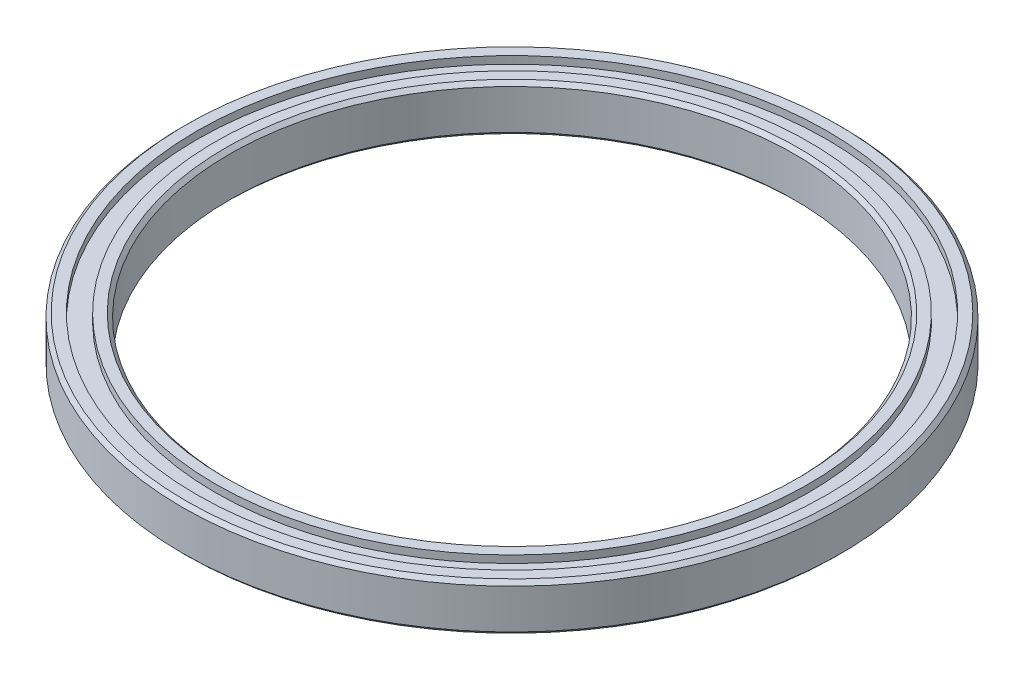
from build123d import *

# Parameters (mm, degrees)
SKETCH_1_R          = 44.45
SKETCH_1_R_2        = 38.1
EXTRUDE_1_DEPTH     = 6.35
SKETCH_2_R          = 42.5
SKETCH_2_R_2        = 40
CUT_EXTRUDE_1_DEPTH = 1
CUT_EXTRUDE_START   = -1
SKETCH_3_R          = 42.5
SKETCH_3_R_2        = 40
CUT_EXTRUDE_2_DEPTH = 1
CHAMFER_1_SIZE      = 0.5


with BuildPart() as part:
    # 草图1 → 凸台-拉伸1 (new body)
    with BuildSketch(Plane(origin=(0, 0, 0), x_dir=(1, 0, 0), z_dir=(0, 1, 0))):
        with Locations(Location((0, 0, 0), (0, 0, 270))):
            Circle(SKETCH_1_R)
        with Locations(Location((0, 0, 0), (0, 0, 270))):
            Circle(SKETCH_1_R_2, mode=Mode.SUBTRACT)
    extrude(amount=EXTRUDE_1_DEPTH)

    # 草图2 → 切除-拉伸1 (cut)
    with BuildSketch(Plane(origin=(0, 6.35, 0), x_dir=(1, 0, 0), z_dir=(0, 1, 0))):
        with Locations(Location((0, 0, 0), (0, 0, 270))):
            Circle(SKETCH_2_R)
        with Locations(Location((0, 0, 0), (0, 0, 270))):
            Circle(SKETCH_2_R_2, mode=Mode.SUBTRACT)
    extrude(amount=-CUT_EXTRUDE_1_DEPTH, mode=Mode.SUBTRACT)

    # 草图3 → 切除-拉伸2 (cut)
    with BuildSketch(Plane.XZ.offset(CUT_EXTRUDE_START)):
        with Locations(Location((0, 0, 0), (0, 0, 90))):
            Circle(SKETCH_3_R)
        with Locations(Location((0, 0, 0), (0, 0, 90))):
            Circle(SKETCH_3_R_2, mode=Mode.SUBTRACT)
    extrude(amount=CUT_EXTRUDE_2_DEPTH, mode=Mode.SUBTRACT)

    # 倒角1
    chamfer_1_edges = [part.edges().sort_by_distance(p)[0] for p in [
        (0, 0, -44.45),
        (0, 6.35, -44.45),
        (0, 0, -38.1),
        (0, 6.35, -38.1),
    ]]
    chamfer(chamfer_1_edges, length=CHAMFER_1_SIZE)


solid = part.part
